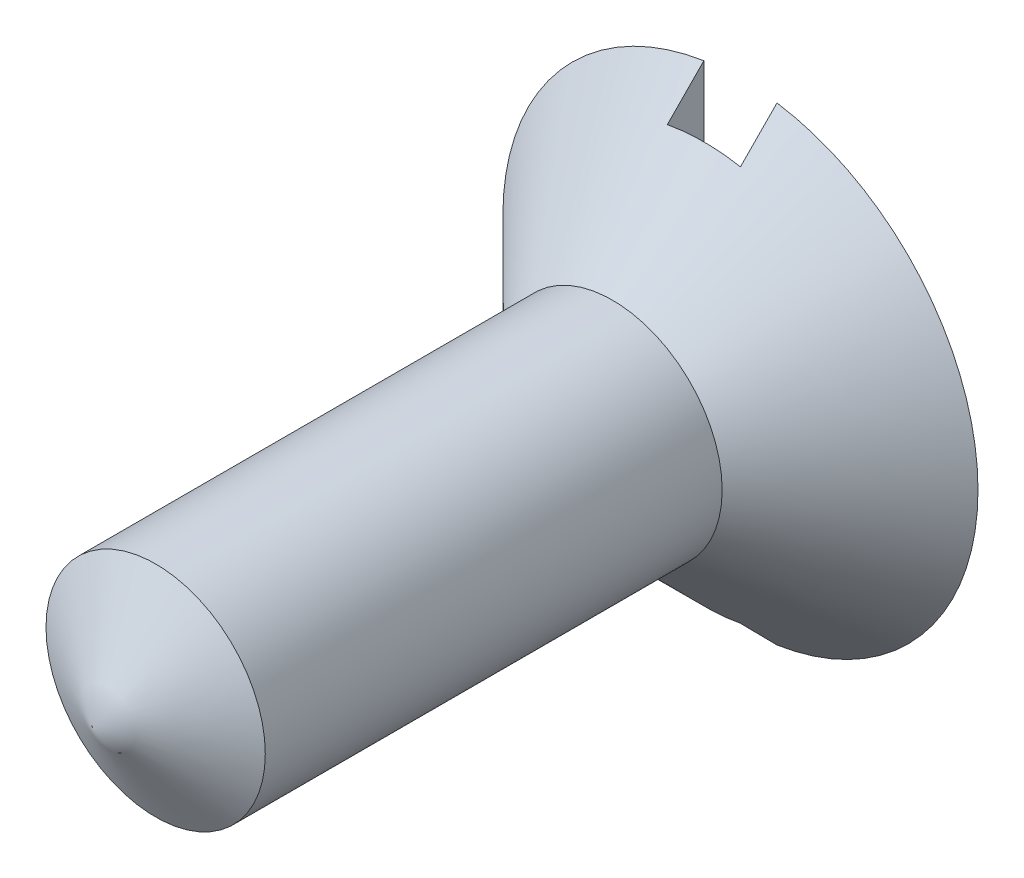
from build123d import *

# Parameters (mm, degrees)
CUT_EXTRUDE1_DEPTH      = 50.614070771
CUT_EXTRUDE1_DEPTH_BACK = 12
SKETCH2_W               = 2
SKETCH2_H               = 1


with BuildPart() as part:
    # Sketch1 → Revolve1 (revolve)
    with BuildSketch(Plane(origin=(0, 0, 0), x_dir=(1, 0, 0), z_dir=(0, 1, 0)), mode=Mode.PRIVATE) as revolve1_sk:
        Polygon((9.697241479, 48.221048581), (6.197241479, 44.721048581), (6.197241479, 32.221048581), (3.197241479, 30.488997773), (3.197241479, 48.221048581), align=None)
    revolve(revolve1_sk.sketch.rotate(Axis((3.197241479, 0, -48.221048581), (0, 0, 1)), 180), axis=Axis((3.197241479, 0, -48.221048581), (0, 0, 1)))

    # Sketch2 → Cut-Extrude1 (cut, two sides: drawn at the far end of the back side and taken through both)
    with BuildSketch(Plane(origin=(0, 0, 0), x_dir=(1, 0, 0), z_dir=(0, 1, 0)).offset(-CUT_EXTRUDE1_DEPTH_BACK)):
        with Locations((3.197241479, 47.721048581)):
            Rectangle(SKETCH2_W, SKETCH2_H)
    extrude(amount=CUT_EXTRUDE1_DEPTH + CUT_EXTRUDE1_DEPTH_BACK, mode=Mode.SUBTRACT)


solid = part.part
